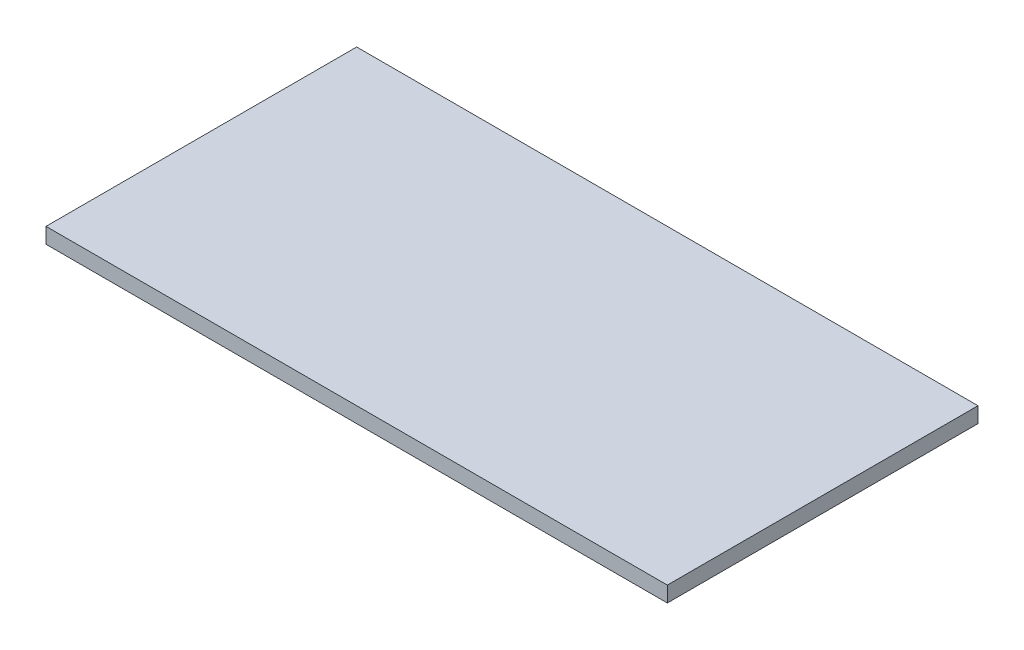
from build123d import *

# Parameters (mm, degrees)
SKETCH1_W           = 80
SKETCH1_H           = 40
BOSS_EXTRUDE1_DEPTH = 2


with BuildPart() as part:
    # Sketch1 → Boss-Extrude1 (new body)
    with BuildSketch(Plane(origin=(0, 0, 0), x_dir=(1, 0, 0), z_dir=(0, 1, 0))):
        with Locations((40, -20)):
            Rectangle(SKETCH1_W, SKETCH1_H)
    extrude(amount=BOSS_EXTRUDE1_DEPTH)


solid = part.part
